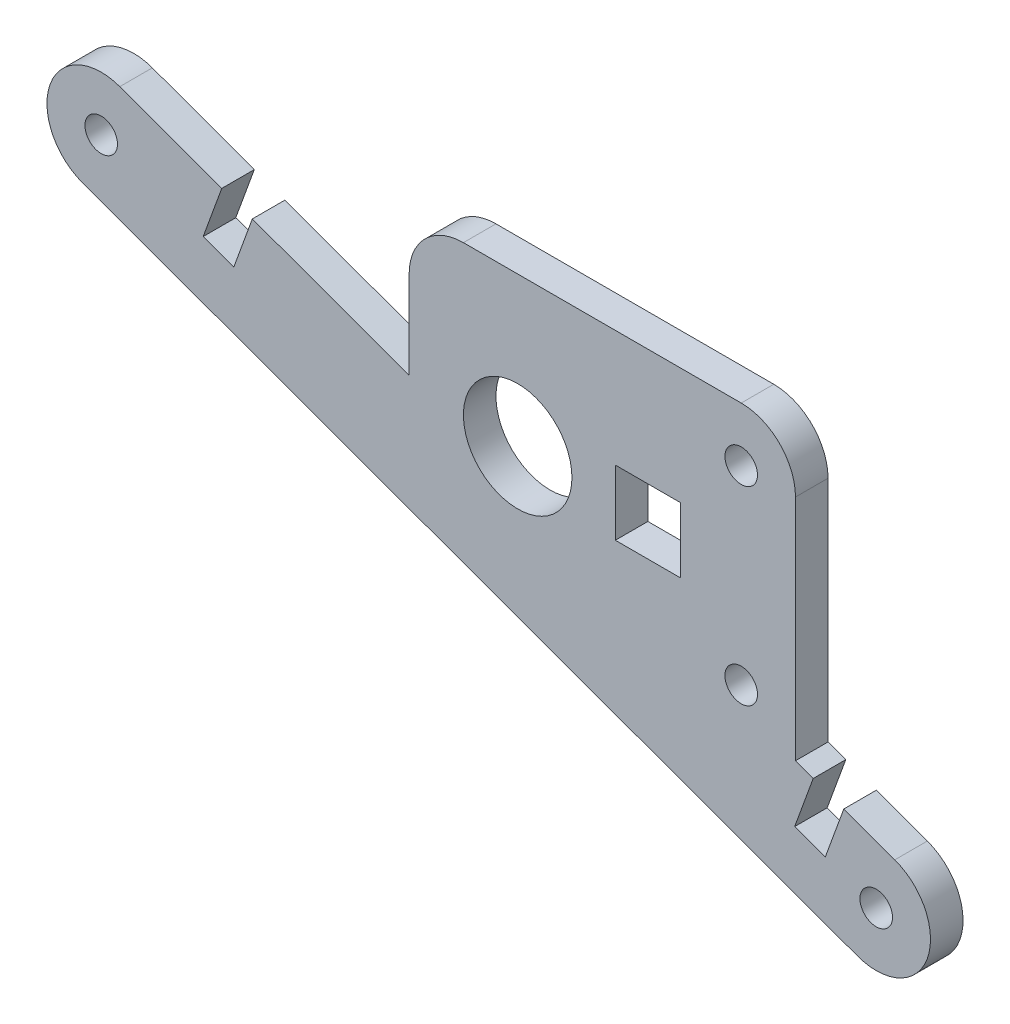
from build123d import *

# Parameters (mm, degrees)
SKETCH1_R           = 5
SKETCH1_R_2         = 1.5
SKETCH1_W           = 6
SKETCH1_H           = 6
BOSS_EXTRUDE1_DEPTH = 3
CUT_EXTRUDE1_DEPTH  = 51.318077676


with BuildPart() as part:
    # Sketch1 → Boss-Extrude1 (new body)
    with BuildSketch(Plane.XY):
        with BuildLine():
            Line((25.6, -12.03135802), (25.6, 8.75))
            ThreePointArc((25.6, 8.75), (24.135533906, 12.285533906), (20.6, 13.75))
            Line((20.6, 13.75), (-5, 13.75))
            ThreePointArc((-5, 13.75), (-8.535533906, 12.285533906), (-10, 8.75))
            Line((-10, 8.75), (-10, 0.66000458))
            Line((-10, 0.66000458), (-36.665975991, 10.365626108))
            ThreePointArc((-36.665975991, 10.365626108), (-43.074539812, 7.377263721), (-40.086177424, 0.9686999))
            Line((-40.086177424, 0.9686999), (31.330461755, -25.024830992))
            ThreePointArc((31.330461755, -25.024830992), (37.739025576, -22.036468605), (34.750663189, -15.627904785))
            Line((34.750663189, -15.627904785), (25.6, -12.29733576))
            Line((25.6, -12.29733576), (25.6, -12.03135802))
        make_face()
        Circle(SKETCH1_R, mode=Mode.SUBTRACT)
        with Locations((20.6, 8.75)):
            Circle(SKETCH1_R_2, mode=Mode.SUBTRACT)
        with Locations((20.6, -8.75)):
            Circle(SKETCH1_R_2, mode=Mode.SUBTRACT)
        with Locations((-38.376076708, 5.667163004)):
            Circle(SKETCH1_R_2, mode=Mode.SUBTRACT)
        with Locations((33.040562472, -20.326367889)):
            Circle(SKETCH1_R_2, mode=Mode.SUBTRACT)
        with Locations((12, 0)):
            Rectangle(SKETCH1_W, SKETCH1_H, mode=Mode.SUBTRACT)
    extrude(amount=BOSS_EXTRUDE1_DEPTH)

    # Sketch2 → Cut-Extrude1 (cut, through all)
    with BuildSketch(Plane(origin=(0, 0, 0), x_dir=(-1, 0, 0), z_dir=(0, 0, -1))):
        Polygon((24.449971921, 5.919364245), (27.269049783, 6.945424675), (28.9791505, 2.246961571), (26.160072638, 1.220901141), align=None)
        Polygon((-30.052200085, -13.917804068), (-27.233122222, -12.891743638), (-25.523021506, -17.590206742), (-28.342099368, -18.616267172), align=None)
    extrude(amount=-CUT_EXTRUDE1_DEPTH, mode=Mode.SUBTRACT)


solid = part.part
